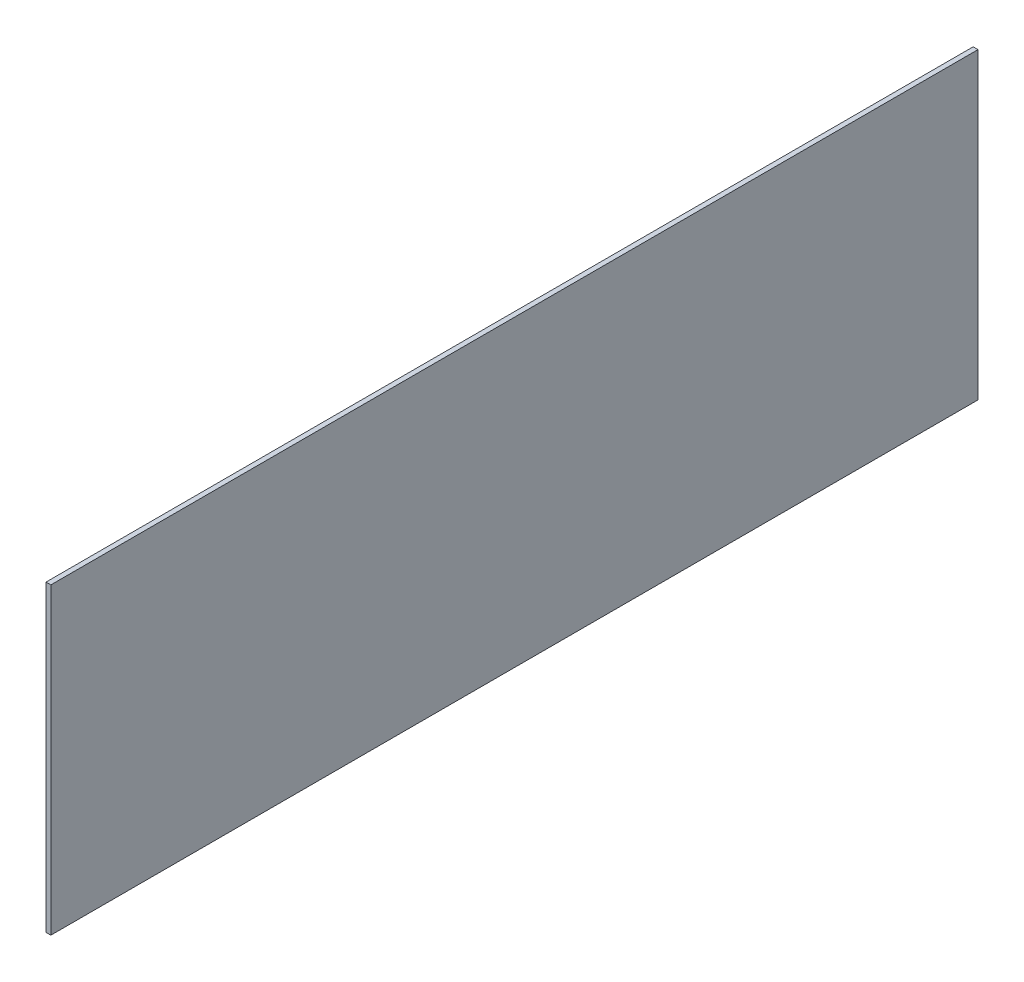
from build123d import *

# Parameters (mm, degrees)
SKETCH1_W           = 125
SKETCH1_H           = 382
BOSS_EXTRUDE1_DEPTH = 2


with BuildPart() as part:
    # Sketch1 → Boss-Extrude1 (new body)
    with BuildSketch(Plane(origin=(532, 0, 0), x_dir=(0, -1, 0), z_dir=(-1, 0, 0))):
        with Locations((12.5, -191)):
            Rectangle(SKETCH1_W, SKETCH1_H)
    extrude(amount=-BOSS_EXTRUDE1_DEPTH)


solid = part.part
